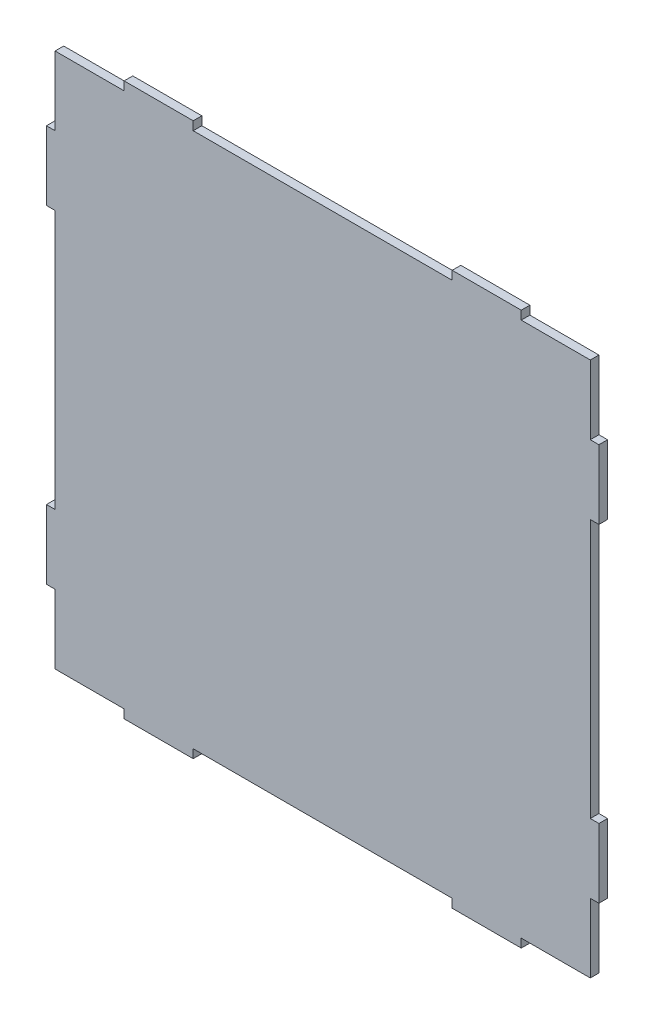
from build123d import *

# Parameters (mm, degrees)
BOSS_EXTRUDE1_DEPTH = 3.175


with BuildPart() as part:
    # Sketch2 → Boss-Extrude1 (new body)
    with BuildSketch(Plane.XY):
        Polygon((-50.8, 70.014936972), (-25.4, 70.014936972), (-25.4, 73.189936972), (0, 73.189936972), (0, 70.014936972), (95.25, 70.014936972), (95.25, 73.189936972), (120.65, 73.189936972), (120.65, 70.014936972), (146.05, 70.014936972), (146.05, 44.614936972), (149.225, 44.614936972), (149.225, 19.214936972), (146.05, 19.214936972), (146.05, -76.035063028), (149.225, -76.035063028), (149.225, -101.435063028), (146.05, -101.435063028), (146.05, -126.835063028), (120.65, -126.835063028), (120.65, -130.010063028), (95.25, -130.010063028), (95.25, -126.835063028), (0, -126.835063028), (0, -130.010063028), (-25.4, -130.010063028), (-25.4, -126.835063028), (-50.8, -126.835063028), (-50.8, -101.435063028), (-53.975, -101.435063028), (-53.975, -76.035063028), (-50.8, -76.035063028), (-50.8, 19.214936972), (-53.975, 19.214936972), (-53.975, 44.614936972), (-50.8, 44.614936972), align=None)
    extrude(amount=BOSS_EXTRUDE1_DEPTH)


solid = part.part
